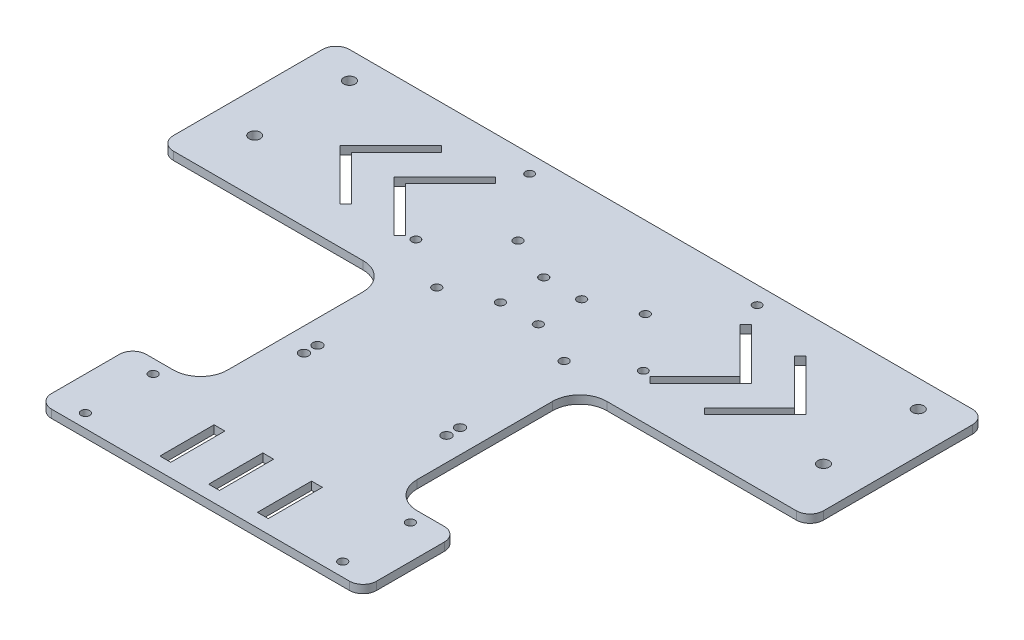
from build123d import *

# Parameters (mm, degrees)
SKETCH_1_W            = 240
SKETCH_1_H            = 65
SKETCH_1_R            = 2.1
EXTRUDE_1_DEPTH       = 3
SKETCH_3_R            = 1.6
CUT_EXTRUDE_1_DEPTH   = 125.359358313
EXTRUDE_2_DEPTH       = 3
FILLET_1_R            = 10
SKETCH_5_R            = 1.6
SKETCH_5_W            = 4
SKETCH_5_H            = 20
CUT_EXTRUDE_2_DEPTH   = 183.524655869
FILLET_2_R            = 10
CUT_EXTRUDE_1_2_DEPTH = 183.524655869
SKETCH_8_R            = 1.75
CUT_EXTRUDE_5_DEPTH   = 183.524655869
SKETCH_9_R            = 1.55
CUT_EXTRUDE_6_DEPTH   = 183.524655869
FILLET_3_R            = 5


with BuildPart() as part:
    # 草图1 → 凸台-拉伸1 (new body)
    # profile 1 of 2: a face of its own
    with BuildSketch(Plane(origin=(0, 0, 0), x_dir=(1, 0, 0), z_dir=(0, 1, 0))):
        Rectangle(SKETCH_1_W, SKETCH_1_H)
        with Locations(Location((105, -12.5, 0), (0, 0, 270))):
            Circle(SKETCH_1_R, mode=Mode.SUBTRACT)
        with Locations(Location((-105, -12.5, 0), (0, 0, 270))):
            Circle(SKETCH_1_R, mode=Mode.SUBTRACT)
        with Locations(Location((-105, 22.5, 0), (0, 0, 270))):
            Circle(SKETCH_1_R, mode=Mode.SUBTRACT)
        with Locations(Location((105, 22.5, 0), (0, 0, 270))):
            Circle(SKETCH_1_R, mode=Mode.SUBTRACT)
    # profile 2 of 2: a face of its own
    with BuildSketch(Plane(origin=(0, 0, 0), x_dir=(1, 0, 0), z_dir=(0, 1, 0))):
        Polygon((-120, 32.5), (-120, -32.5), (-60, -32.5), (20, -32.5), (120, -32.5), (120, 32.5), align=None)
        with Locations(Location((-105, -12.5, 0), (0, 0, 270))):
            Circle(SKETCH_1_R, mode=Mode.SUBTRACT)
        with Locations(Location((105, -12.5, 0), (0, 0, 270))):
            Circle(SKETCH_1_R, mode=Mode.SUBTRACT)
        with Locations(Location((-105, 22.5, 0), (0, 0, 270))):
            Circle(SKETCH_1_R, mode=Mode.SUBTRACT)
        with Locations(Location((105, 22.5, 0), (0, 0, 270))):
            Circle(SKETCH_1_R, mode=Mode.SUBTRACT)
    extrude(amount=EXTRUDE_1_DEPTH)

    # 草图3 → Cut-Extrude 1 (cut, through all)
    with BuildSketch(Plane(origin=(0, 3, 0), x_dir=(1, 0, 0), z_dir=(0, 1, 0))):
        with Locations(Location((-22.773937698, 2.5, 0), (0, 0, 270))):
            Circle(SKETCH_3_R)
        with Locations(Location((24.226062302, 2.5, 0), (0, 0, 90))):
            Circle(SKETCH_3_R)
        with Locations(Location((24.226062302, -27.5, 0), (0, 0, 270))):
            Circle(SKETCH_3_R)
        with Locations(Location((-22.773937698, -27.5, 0), (0, 0, 90))):
            Circle(SKETCH_3_R)
        with Locations(Location((-6.273937698, -4.5, 0), (0, 0, 270))):
            Circle(SKETCH_3_R)
        with Locations(Location((7.726062302, -4.5, 0), (0, 0, 90))):
            Circle(SKETCH_3_R)
        with Locations(Location((7.726062302, -20.5, 0), (0, 0, 270))):
            Circle(SKETCH_3_R)
        with Locations(Location((-6.273937698, -20.5, 0), (0, 0, 90))):
            Circle(SKETCH_3_R)
    extrude(amount=-CUT_EXTRUDE_1_DEPTH, mode=Mode.SUBTRACT)

    # 草图4 → 凸台-拉伸2 (add)
    with BuildSketch(Plane(origin=(0, 0, 0), x_dir=(1, 0, 0), z_dir=(0, 1, 0))):
        Polygon((0, -32.5), (-35, -32.5), (-35, -102.5), (-60, -102.5), (-60, -137.5), (60, -137.5), (60, -102.5), (35, -102.5), (35, -32.5), align=None)
    extrude(amount=EXTRUDE_2_DEPTH)

    # 圆角1
    fillet_1_edges = [part.edges().sort_by_distance(p)[0] for p in [
        (35, 1.5, 32.5),
        (-35, 1.5, 32.5),
    ]]
    fillet(fillet_1_edges, radius=FILLET_1_R)

    # 草图5 → 切除-拉伸2 (cut, through all)
    with BuildSketch(Plane(origin=(0, 3, 0), x_dir=(1, 0, 0), z_dir=(0, 1, 0))):
        with Locations(Location((-47.5, -132.5, 0), (0, 0, 270))):
            Circle(SKETCH_5_R)
        with Locations(Location((47.5, -132.5, 0), (0, 0, 90))):
            Circle(SKETCH_5_R)
        with Locations(Location((-47.5, -107.5, 0), (0, 0, 270))):
            Circle(SKETCH_5_R)
        with Locations(Location((47.5, -107.5, 0), (0, 0, 90))):
            Circle(SKETCH_5_R)
        with Locations((0, -122.5)):
            Rectangle(SKETCH_5_W, SKETCH_5_H)
        with Locations((-18, -122.5)):
            Rectangle(SKETCH_5_W, SKETCH_5_H)
        with Locations((18, -122.5)):
            Rectangle(SKETCH_5_W, SKETCH_5_H)
    extrude(amount=-CUT_EXTRUDE_2_DEPTH, mode=Mode.SUBTRACT)

    # 圆角2
    fillet_2_edges = [part.edges().sort_by_distance(p)[0] for p in [
        (35, 1.5, 102.5),
        (-35, 1.5, 102.5),
    ]]
    fillet(fillet_2_edges, radius=FILLET_2_R)

    # 草图7 → Cut-Extrude 1 2 (cut, through all)
    with BuildSketch(Plane(origin=(0, 3, 0), x_dir=(1, 0, 0), z_dir=(0, 1, 0))):
        Polygon((-45.148639148, -16.617009358), (-61.765648506, 0), (-45.148639148, 16.617009358), (-47.269959491, 18.738329701), (-66.008289193, 0), (-47.269959491, -18.738329701), align=None)
        Polygon((-65.148639148, -16.617009358), (-81.765648506, 0), (-65.148639148, 16.617009358), (-67.269959491, 18.738329701), (-86.008289193, 0), (-67.269959491, -18.738329701), align=None)
        Polygon((65.148639148, 16.617009358), (81.765648506, 0), (65.148639148, -16.617009358), (67.269959491, -18.738329701), (86.008289193, 0), (67.269959491, 18.738329701), align=None)
        Polygon((45.148639148, 16.617009358), (61.765648506, 0), (45.148639148, -16.617009358), (47.269959491, -18.738329701), (66.008289193, 0), (47.269959491, 18.738329701), align=None)
    extrude(amount=-CUT_EXTRUDE_1_2_DEPTH, mode=Mode.SUBTRACT)

    # 草图8 → 切除-拉伸5 (cut, through all)
    with BuildSketch(Plane(origin=(0, 3, 0), x_dir=(1, 0, 0), z_dir=(0, 1, 0))):
        with Locations(Location((-26.316332853, -68, 0), (0, 0, 270))):
            Circle(SKETCH_8_R)
        with Locations(Location((-26.316332853, -73, 0), (0, 0, 90))):
            Circle(SKETCH_8_R)
        with Locations(Location((26.316332853, -73, 0), (0, 0, 270))):
            Circle(SKETCH_8_R)
        with Locations(Location((26.316332853, -68, 0), (0, 0, 90))):
            Circle(SKETCH_8_R)
    extrude(amount=-CUT_EXTRUDE_5_DEPTH, mode=Mode.SUBTRACT)

    # 草图9 → 切除-拉伸6 (cut, through all)
    with BuildSketch(Plane(origin=(0, 3, 0), x_dir=(1, 0, 0), z_dir=(0, 1, 0))):
        with Locations(Location((-42, 26, 0), (0, 0, 270))):
            Circle(SKETCH_9_R)
        with Locations(Location((-42, -16, 0), (0, 0, 270))):
            Circle(SKETCH_9_R)
        with Locations(Location((42, -16, 0), (0, 0, 90))):
            Circle(SKETCH_9_R)
        with Locations(Location((42, 26, 0), (0, 0, 90))):
            Circle(SKETCH_9_R)
    extrude(amount=-CUT_EXTRUDE_6_DEPTH, mode=Mode.SUBTRACT)

    # 圆角3
    fillet_3_edges = [part.edges().sort_by_distance(p)[0] for p in [
        (-120, 1.5, 32.5),
        (-120, 1.5, -32.5),
        (120, 1.5, -32.5),
        (120, 1.5, 32.5),
        (-60, 1.5, 137.5),
        (60, 1.5, 137.5),
        (60, 1.5, 102.5),
        (-60, 1.5, 102.5),
    ]]
    fillet(fillet_3_edges, radius=FILLET_3_R)


solid = part.part
